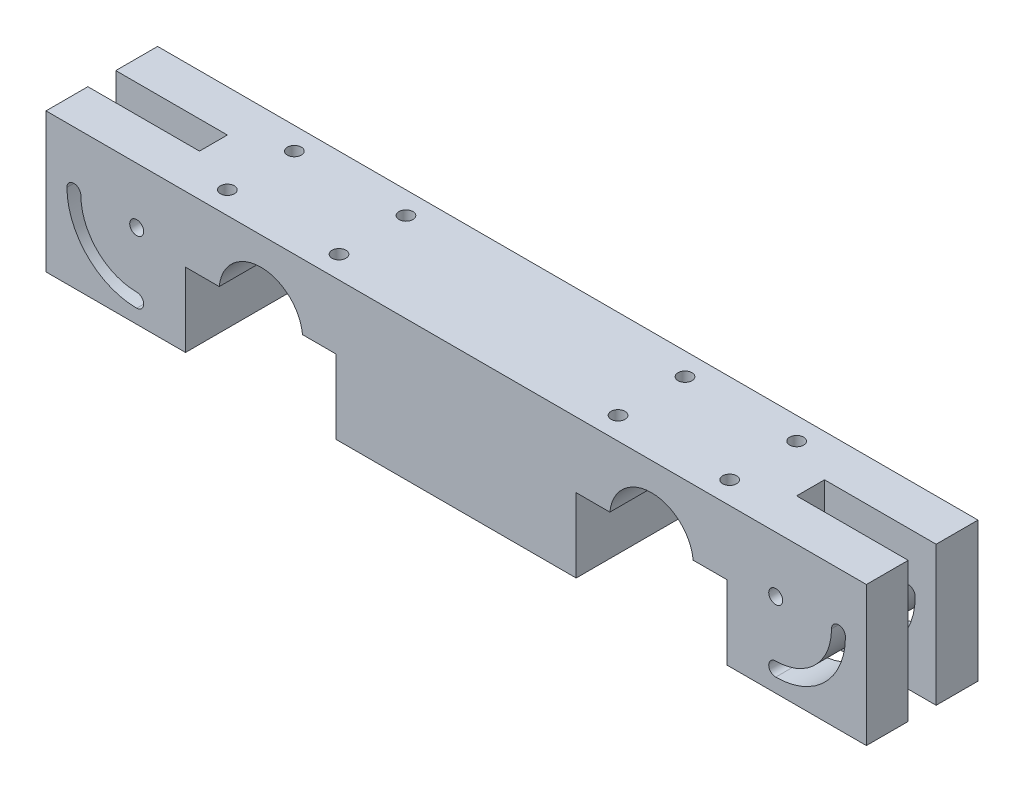
from build123d import *

# Parameters (mm, degrees)
SKETCH1_R           = 2.5
BOSS_EXTRUDE1_DEPTH = 40
SKETCH3_R           = 2.5
CUT_EXTRUDE2_DEPTH  = 23.5
CUT_EXTRUDE3_REACH  = 162.34
SKETCH4_W           = 40
SKETCH4_H           = 10


with BuildPart() as part:
    # Sketch1 → Boss-Extrude1 (new body)
    with BuildSketch(Plane.XY):
        with BuildLine():
            Line((0, 50), (0, 0))
            Line((0, 0), (43, 0))
            Line((43, 0), (43, 26.5))
            Line((43, 26.5), (55.075188443, 26.5))
            ThreePointArc((55.075188443, 26.5), (70, 40), (84.924811557, 26.5))
            Line((84.924811557, 26.5), (97, 26.5))
            Line((97, 26.5), (97, 0))
            Line((97, 0), (147, 0))
            Line((147, 0), (147, 50))
            Line((147, 50), (62, 50))
            Line((62, 50), (23, 50))
            Line((23, 50), (0, 50))
        make_face()
        with BuildLine():
            ThreePointArc((139.5, 30), (132.17766953, 12.32233047), (114.5, 5))
            ThreePointArc((114.5, 5), (112, 7.5), (114.5, 10))
            ThreePointArc((114.5, 10), (128.642135624, 15.857864376), (134.5, 30))
            ThreePointArc((134.5, 30), (137, 32.5), (139.5, 30))
        make_face(mode=Mode.SUBTRACT)
        with Locations((114.5, 30)):
            Circle(SKETCH1_R, mode=Mode.SUBTRACT)
    boss_extrude1 = extrude(amount=BOSS_EXTRUDE1_DEPTH)

    # Sketch3 → Cut-Extrude2 (cut)
    with BuildSketch(Plane(origin=(0, 50, 0), x_dir=(1, 0, 0), z_dir=(0, 1, 0))):
        with Locations(Location((50, -32, 0), (0, 0, 270))):
            Circle(SKETCH3_R)
        with Locations(Location((90, -32, 0), (0, 0, 270))):
            Circle(SKETCH3_R)
        with Locations(Location((50, -8, 0), (0, 0, 270))):
            Circle(SKETCH3_R)
        with Locations(Location((90, -8, 0), (0, 0, 270))):
            Circle(SKETCH3_R)
    cut_extrude2 = extrude(amount=-CUT_EXTRUDE2_DEPTH, mode=Mode.SUBTRACT)

    # Cut-Extrude3: up to this face of the body (flat: up to its plane)
    cut_extrude3_end = Plane(part.part.faces().sort_by_distance((122, 0, 20))[0])
    # Sketch4 → Cut-Extrude3 (cut, up to the picked face)
    with BuildSketch(Plane(origin=(0, 50, 0), x_dir=(1, 0, 0), z_dir=(0, 1, 0)), mode=Mode.PRIVATE) as cut_extrude3_sk1:
        with Locations((127, -20)):
            Rectangle(SKETCH4_W, SKETCH4_H)
    cut_extrude3_tool1 = split(extrude(cut_extrude3_sk1.sketch, amount=-CUT_EXTRUDE3_REACH, mode=Mode.PRIVATE), bisect_by=cut_extrude3_end, keep=Keep.BOTH, mode=Mode.PRIVATE)
    cut_extrude3 = cut_extrude3_tool1.solids().sort_by(Axis((127, 50, 20), (0, -1, 0)))[0]
    add(cut_extrude3, mode=Mode.SUBTRACT)

    # Mirror2: Boss-Extrude1, Cut-Extrude2, Cut-Extrude3 across plane
    add(boss_extrude1.mirror(Plane(origin=(0, 0, 40), x_dir=(0, 0, 1), z_dir=(-1, 0, 0))))
    add(cut_extrude2.mirror(Plane(origin=(0, 0, 40), x_dir=(0, 0, 1), z_dir=(-1, 0, 0))), mode=Mode.SUBTRACT)
    add(cut_extrude3.mirror(Plane(origin=(0, 0, 40), x_dir=(0, 0, 1), z_dir=(-1, 0, 0))), mode=Mode.SUBTRACT)


solid = part.part
